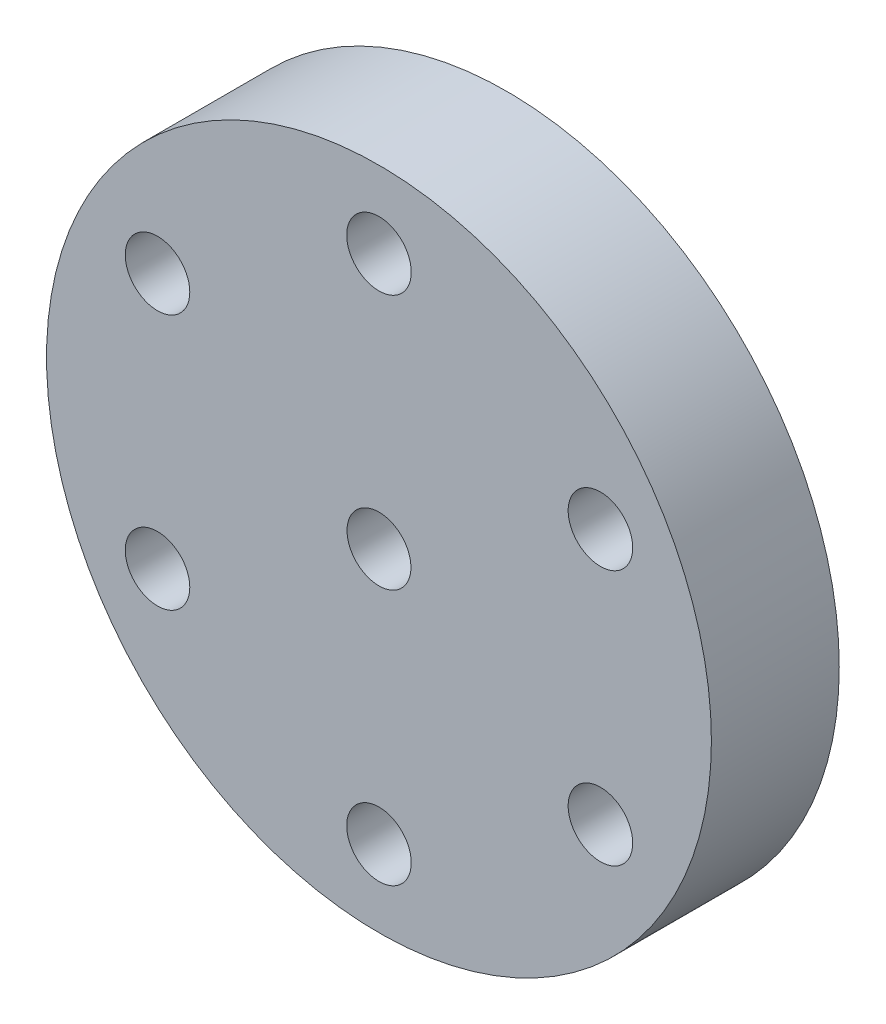
from build123d import *

# Parameters (mm, degrees)
SKETCH3_R           = 26
SKETCH3_R_2         = 2.5
SKETCH3_R_3         = 2.523593649
BOSS_EXTRUDE2_DEPTH = 10


with BuildPart() as part:
    # Sketch3 → Boss-Extrude2 (new body)
    with BuildSketch(Plane.XY):
        Circle(SKETCH3_R)
        Circle(SKETCH3_R_2, mode=Mode.SUBTRACT)
        with Locations((0, 20)):
            Circle(SKETCH3_R_3, mode=Mode.SUBTRACT)
        with Locations((17.320508076, 10)):
            Circle(SKETCH3_R_3, mode=Mode.SUBTRACT)
        with Locations((17.320508076, -10)):
            Circle(SKETCH3_R_3, mode=Mode.SUBTRACT)
        with Locations((0, -20)):
            Circle(SKETCH3_R_3, mode=Mode.SUBTRACT)
        with Locations((-17.320508076, -10)):
            Circle(SKETCH3_R_3, mode=Mode.SUBTRACT)
        with Locations((-17.320508076, 10)):
            Circle(SKETCH3_R_3, mode=Mode.SUBTRACT)
    extrude(amount=BOSS_EXTRUDE2_DEPTH)


solid = part.part
